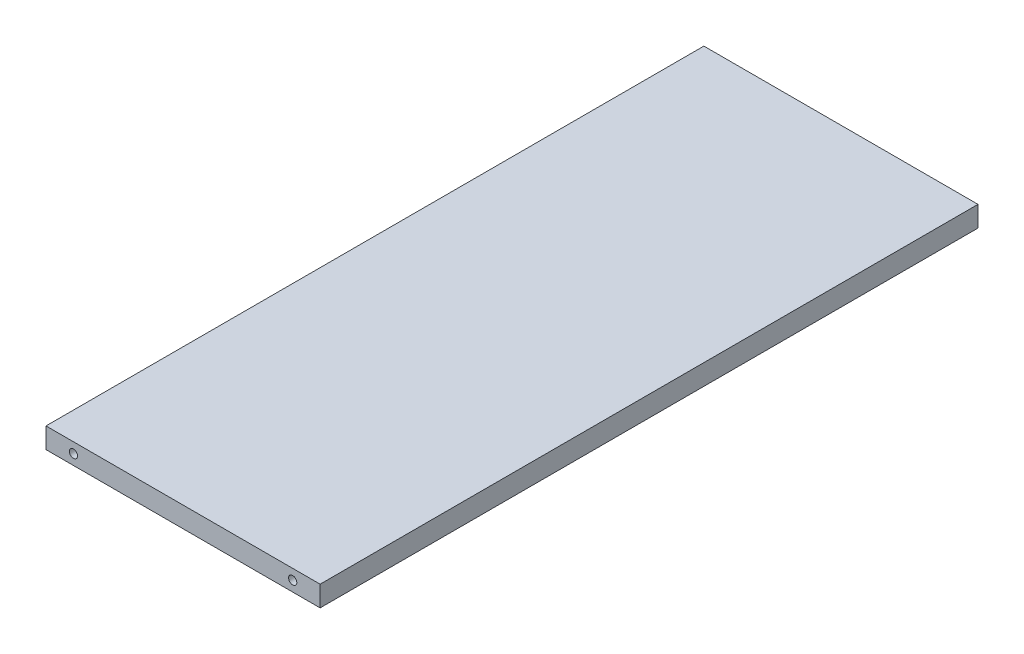
from build123d import *

# Parameters (mm, degrees)
SKETCH1_W                  = 127
SKETCH1_H                  = 304.8
BOSS_EXTRUDE1_DEPTH        = 9.525
F_10_24_TAPPED_HOLE1_D     = 3.7973
F_10_24_TAPPED_HOLE1_DEPTH = 24.384
F_10_24_TAPPED_HOLE1_TIP   = 1.140824014
F_10_24_TAPPED_HOLE2_D     = 3.7973
F_10_24_TAPPED_HOLE2_DEPTH = 24.384
F_10_24_TAPPED_HOLE2_TIP   = 1.140824014


with BuildPart() as part:
    # Sketch1 → Boss-Extrude1 (new body)
    with BuildSketch(Plane(origin=(0, 0, 0), x_dir=(1, 0, 0), z_dir=(0, 1, 0))):
        with Locations((23.881772484, -118.226382698)):
            Rectangle(SKETCH1_W, SKETCH1_H)
    extrude(amount=BOSS_EXTRUDE1_DEPTH)

    # #10-24 Tapped Hole1
    with Locations(Plane.XY.offset(270.626382698)):
        with Locations((-26.918227516, 4.7625), (74.681772484, 4.7625)):
            Hole(F_10_24_TAPPED_HOLE1_D / 2, depth=F_10_24_TAPPED_HOLE1_DEPTH)
            with Locations((0, 0, -(F_10_24_TAPPED_HOLE1_DEPTH + F_10_24_TAPPED_HOLE1_TIP / 2))):  # 118° drill point
                Cone(0, F_10_24_TAPPED_HOLE1_D / 2, F_10_24_TAPPED_HOLE1_TIP, mode=Mode.SUBTRACT)

    # #10-24 Tapped Hole2
    with Locations(Plane(origin=(0, 0, -34.173617302), x_dir=(-1, 0, 0), z_dir=(0, 0, -1))):
        with Locations((-74.681772484, 4.7625), (26.918227516, 4.7625)):
            Hole(F_10_24_TAPPED_HOLE2_D / 2, depth=F_10_24_TAPPED_HOLE2_DEPTH)
            with Locations((0, 0, -(F_10_24_TAPPED_HOLE2_DEPTH + F_10_24_TAPPED_HOLE2_TIP / 2))):  # 118° drill point
                Cone(0, F_10_24_TAPPED_HOLE2_D / 2, F_10_24_TAPPED_HOLE2_TIP, mode=Mode.SUBTRACT)


solid = part.part
